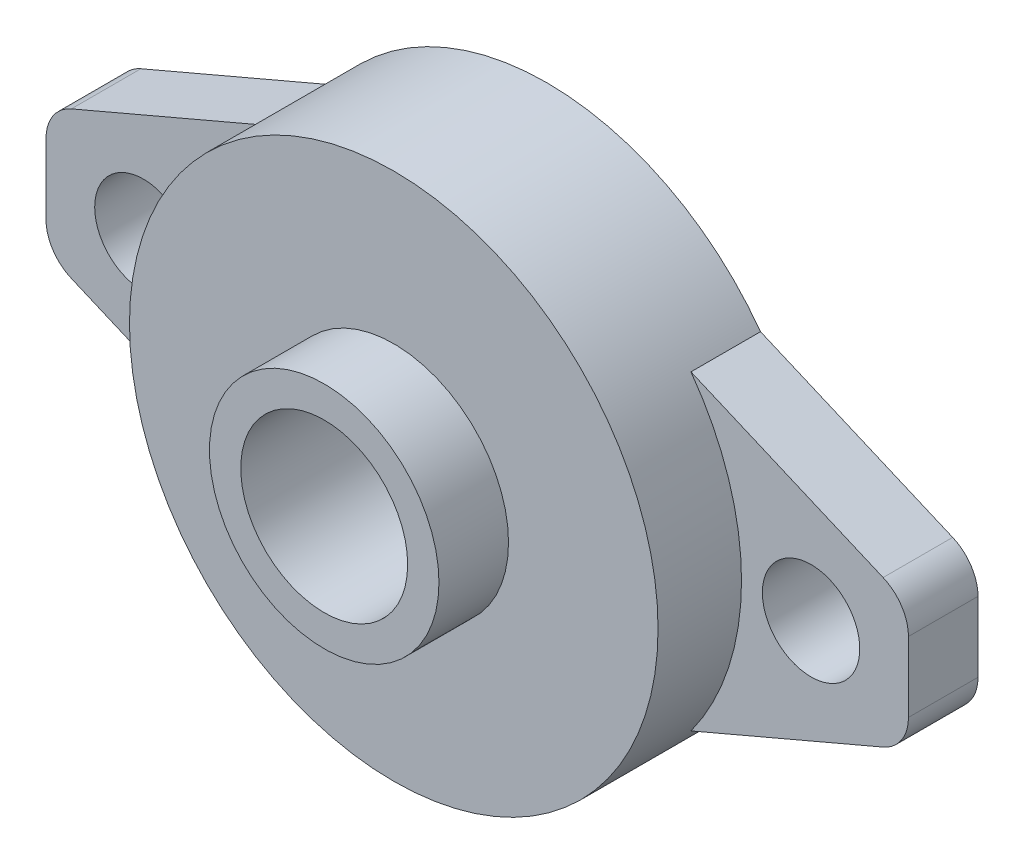
from build123d import *

# Parameters (mm, degrees)
SKETCH1_R           = 19
SKETCH1_R_2         = 6
BOSS_EXTRUDE1_DEPTH = 11
SKETCH2_R           = 8.25
SKETCH2_R_2         = 6
BOSS_EXTRUDE2_DEPTH = 5
SKETCH3_R           = 3.5
BOSS_EXTRUDE3_DEPTH = 5
FILLET1_R           = 3


with BuildPart() as part:
    # Sketch1 → Boss-Extrude1 (new body)
    with BuildSketch(Plane.XY):
        Circle(SKETCH1_R)
        Circle(SKETCH1_R_2, mode=Mode.SUBTRACT)
    extrude(amount=BOSS_EXTRUDE1_DEPTH)

    # Sketch2 → Boss-Extrude2 (add)
    with BuildSketch(Plane.XY.offset(11)):
        Circle(SKETCH2_R)
        Circle(SKETCH2_R_2, mode=Mode.SUBTRACT)
    extrude(amount=BOSS_EXTRUDE2_DEPTH)

    # Sketch3 → Boss-Extrude3 (add)
    # profile 1 of 2: a face of its own
    with BuildSketch(Plane(origin=(0, 0, 0), x_dir=(-1, 0, 0), z_dir=(0, 0, -1))):
        with BuildLine():
            Line((31, 4.5), (31, -4.5))
            Line((31, -4.5), (15.364682716, -11.177053505))
            ThreePointArc((15.364682716, -11.177053505), (19, 0), (15.364682716, 11.177053505))
            Line((15.364682716, 11.177053505), (31, 4.5))
        make_face()
        with Locations((24, 0)):
            Circle(SKETCH3_R, mode=Mode.SUBTRACT)
    # profile 2 of 2: a face of its own
    with BuildSketch(Plane(origin=(0, 0, 0), x_dir=(-1, 0, 0), z_dir=(0, 0, -1))):
        with BuildLine():
            Line((-15.364682716, -11.177053505), (-31, -4.5))
            Line((-31, -4.5), (-31, 4.5))
            Line((-31, 4.5), (-15.364682716, 11.177053505))
            ThreePointArc((-15.364682716, 11.177053505), (-19, 0), (-15.364682716, -11.177053505))
        make_face()
        with Locations((-24, 0)):
            Circle(SKETCH3_R, mode=Mode.SUBTRACT)
    extrude(amount=-BOSS_EXTRUDE3_DEPTH)

    # Fillet1
    fillet1_edges = [part.edges().sort_by_distance(p)[0] for p in [
        (31, -4.5, 2.5),
        (31, 4.5, 2.5),
        (-31, 4.5, 2.5),
        (-31, -4.5, 2.5),
    ]]
    fillet(fillet1_edges, radius=FILLET1_R)


solid = part.part
